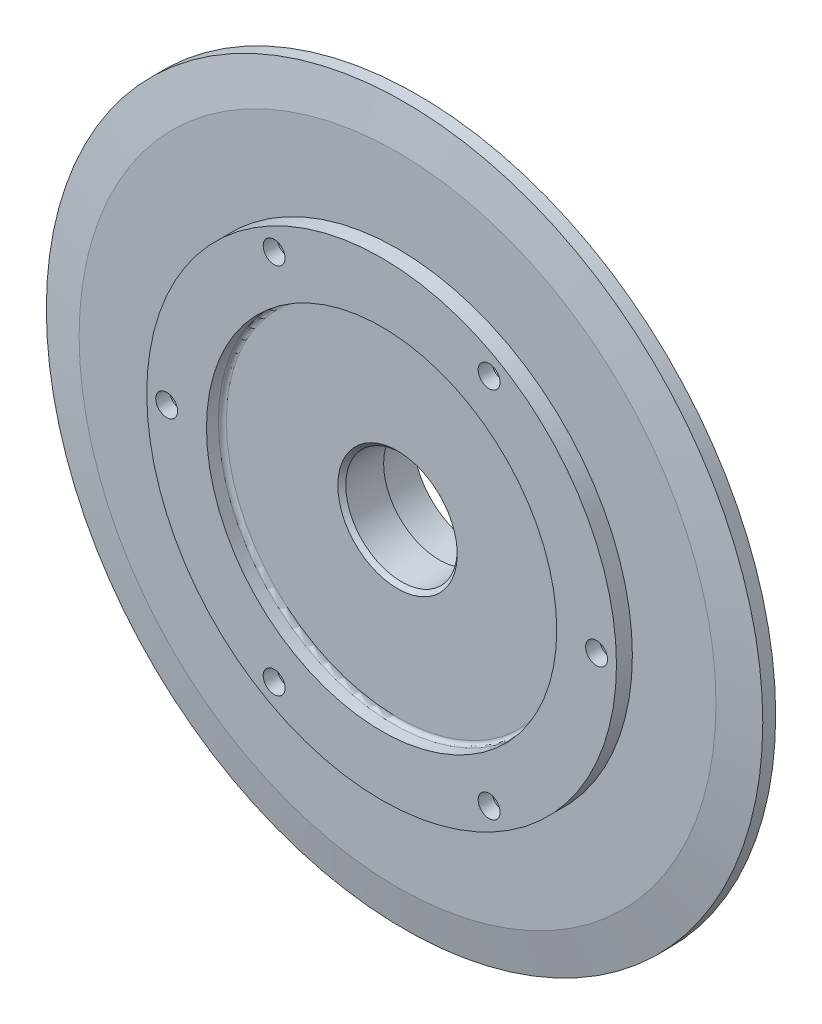
from build123d import *

# Parameters (mm, degrees)
SKETCH_3_R                = 77
SKETCH_3_R_2              = 70
CUT_EXTRUDE_1_DEPTH       = 4
HOLE_WIZARD_1_D           = 11
HOLE_WIZARD_1_CBORE_D     = 17
HOLE_WIZARD_1_CBORE_DEPTH = 11
FILLET_1_R                = 2
CHAMFER_1_SIZE            = 2


with BuildPart() as part:
    # 草图1 → 旋转1 (revolve)
    with BuildSketch(Plane(origin=(0, 0, 0), x_dir=(0, 0, -1), z_dir=(1, 0, 0)), mode=Mode.PRIVATE) as revolve_1_sk:
        Polygon((0, 0), (0, 118), (8, 118), (8, 160), (11.526539614, 180), (18, 180), (18, 45), (21, 45), (21, 40), (47, 40), (47, 0), align=None)
    revolve(revolve_1_sk.sketch.rotate(Axis((0, 0, -47), (0, 0, 1)), 90), axis=Axis((0, 0, -47), (0, 0, 1)))

    # 草图2 → 切除-旋转1 (revolve, cut)
    with BuildSketch(Plane(origin=(0, 0, 0), x_dir=(0, 0, -1), z_dir=(1, 0, 0)), mode=Mode.PRIVATE) as cut_revolve_1_sk:
        Polygon((0, 0), (0, 88), (8, 88), (8, 28), (29, 28), (29, 31), (47, 31), (47, 0), align=None)
    revolve(cut_revolve_1_sk.sketch.rotate(Axis((0, 0, -47), (0, 0, 1)), 90), axis=Axis((0, 0, -47), (0, 0, 1)), mode=Mode.SUBTRACT)

    # 草图3 → 切除-拉伸1 (cut)
    with BuildSketch(Plane(origin=(0, 0, -18), x_dir=(-1, 0, 0), z_dir=(0, 0, -1))):
        Circle(SKETCH_3_R)
        Circle(SKETCH_3_R_2, mode=Mode.SUBTRACT)
    extrude(amount=-CUT_EXTRUDE_1_DEPTH, mode=Mode.SUBTRACT)

    # 孔1 (through all)
    with Locations(Plane(origin=(0, 0, -18), x_dir=(-1, 0, 0), z_dir=(0, 0, -1))):
        with Locations((54, 93.530743609), (108, 0), (54, -93.530743609), (-54, -93.530743609), (-108, 0), (-54, 93.530743609)):
            CounterBoreHole(HOLE_WIZARD_1_D / 2, HOLE_WIZARD_1_CBORE_D / 2, HOLE_WIZARD_1_CBORE_DEPTH)

    # 圆角1
    fillet_1_edges = [part.edges().sort_by_distance(p)[0] for p in [
        (88, 0, -8),
    ]]
    fillet(fillet_1_edges, radius=FILLET_1_R)

    # 倒角1
    chamfer_1_edges = [part.edges().sort_by_distance(p)[0] for p in [
        (28, 0, -8),
    ]]
    chamfer(chamfer_1_edges, length=CHAMFER_1_SIZE)


solid = part.part
